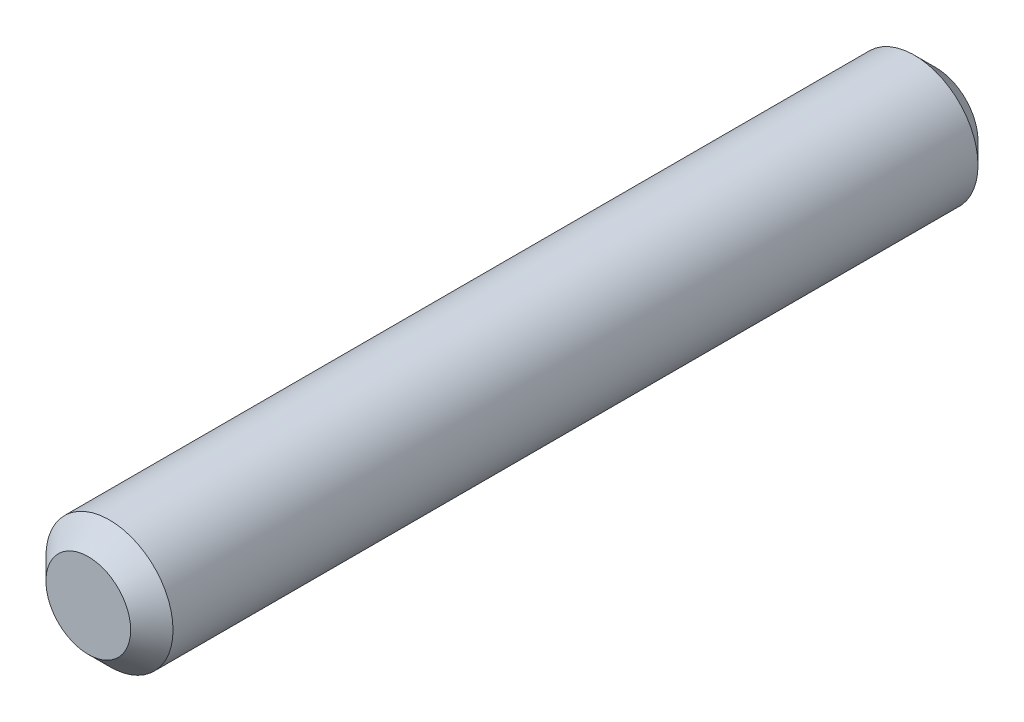
from build123d import *

# Parameters (mm, degrees)
SKETCH_1_R      = 1.5
EXTRUDE_1_DEPTH = 10
CHAMFER_1_SIZE  = 0.5


with BuildPart() as part:
    # 草图1 → 拉伸1 (new, symmetric)
    with BuildSketch(Plane.XY):
        Circle(SKETCH_1_R)
    extrude(amount=EXTRUDE_1_DEPTH, both=True)

    # 倒角1
    chamfer_1_edges = [part.edges().sort_by_distance(p)[0] for p in [
        (-1.5, 0, -10),
        (-1.5, 0, 10),
    ]]
    chamfer(chamfer_1_edges, length=CHAMFER_1_SIZE)


solid = part.part
